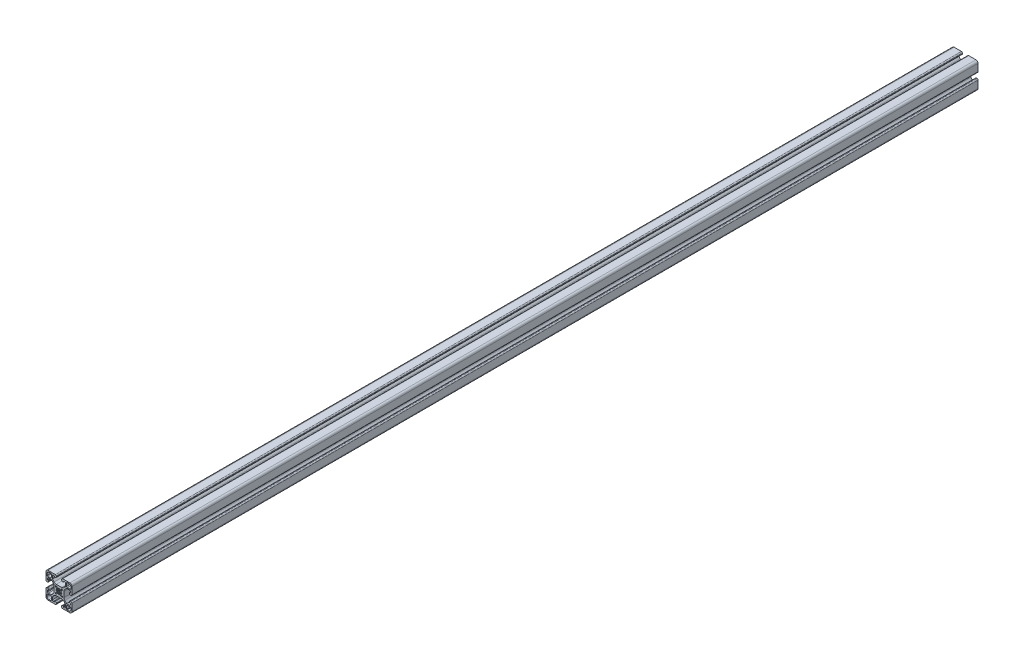
from build123d import *

# Parameters (mm, degrees)
EXTRUDE1_DEPTH = 1400


with BuildPart() as part:
    # Sketch1 → Extrude1 (new body)
    with BuildSketch(Plane.XY):
        with BuildLine():
            Line((-5.63, 20), (-16.83, 20))
            ThreePointArc((-16.83, 20), (-19.071528496, 19.071528497), (-20, 16.83))
            Line((-20, 16.83), (-20, 5.63))
            ThreePointArc((-20, 5.63), (-19.540157646, 4.519842354), (-18.43, 4.06))
            Line((-18.43, 4.06), (-17.57, 4.06))
            ThreePointArc((-17.57, 4.06), (-16.459842353, 4.519842354), (-16, 5.63))
            Line((-16, 5.63), (-16, 6.605))
            ThreePointArc((-16, 6.605), (-16.073223305, 6.781776695), (-16.25, 6.855))
            Line((-16.25, 6.855), (-17.25, 6.855))
            ThreePointArc((-17.25, 6.855), (-17.426776695, 6.928223305), (-17.5, 7.105))
            Line((-17.5, 7.105), (-17.5, 9.015))
            ThreePointArc((-17.5, 9.015), (-17.128025612, 9.913025612), (-16.23, 10.285))
            Line((-16.23, 10.285), (-12.216214636, 10.285))
            ThreePointArc((-12.216214636, 10.285), (-11.875626381, 10.217252784), (-11.5868896, 10.024325035))
            Line((-11.5868896, 10.024325035), (-9.076242789, 7.513678224))
            ThreePointArc((-9.076242789, 7.513678224), (-8.046572221, 5.972667318), (-7.685, 4.154921014))
            Line((-7.685, 4.154921014), (-7.685, -4.154921014))
            ThreePointArc((-7.685, -4.154921014), (-8.046572221, -5.972667317), (-9.076242789, -7.513678224))
            Line((-9.076242789, -7.513678224), (-11.5868896, -10.024325035))
            ThreePointArc((-11.5868896, -10.024325035), (-11.875626381, -10.217252784), (-12.216214636, -10.285))
            Line((-12.216214636, -10.285), (-16.23, -10.285))
            ThreePointArc((-16.23, -10.285), (-17.128025612, -9.913025612), (-17.5, -9.015))
            Line((-17.5, -9.015), (-17.5, -7.105))
            ThreePointArc((-17.5, -7.105), (-17.426776695, -6.928223305), (-17.25, -6.855))
            Line((-17.25, -6.855), (-16.25, -6.855))
            ThreePointArc((-16.25, -6.855), (-16.073223305, -6.781776695), (-16, -6.605))
            Line((-16, -6.605), (-16, -5.63))
            ThreePointArc((-16, -5.63), (-16.459842354, -4.519842353), (-17.57, -4.06))
            Line((-17.57, -4.06), (-18.43, -4.06))
            ThreePointArc((-18.43, -4.06), (-19.540157646, -4.519842353), (-20, -5.63))
            Line((-20, -5.63), (-20, -16.83))
            ThreePointArc((-20, -16.83), (-19.071528496, -19.071528496), (-16.83, -20))
            Line((-16.83, -20), (-5.63, -20))
            ThreePointArc((-5.63, -20), (-4.519842354, -19.540157646), (-4.06, -18.43))
            Line((-4.06, -18.43), (-4.06, -17.57))
            ThreePointArc((-4.06, -17.57), (-4.519842354, -16.459842353), (-5.63, -16))
            Line((-5.63, -16), (-6.605, -16))
            ThreePointArc((-6.605, -16), (-6.781776695, -16.073223305), (-6.855, -16.25))
            Line((-6.855, -16.25), (-6.855, -17.25))
            ThreePointArc((-6.855, -17.25), (-6.928223305, -17.426776695), (-7.105, -17.5))
            Line((-7.105, -17.5), (-9.015, -17.5))
            ThreePointArc((-9.015, -17.5), (-9.913025612, -17.128025612), (-10.285, -16.23))
            Line((-10.285, -16.23), (-10.285, -12.216214635))
            ThreePointArc((-10.285, -12.216214635), (-10.217252784, -11.875626381), (-10.024325035, -11.5868896))
            Line((-10.024325035, -11.5868896), (-7.513678224, -9.076242789))
            ThreePointArc((-7.513678224, -9.076242789), (-5.972667317, -8.04657222), (-4.154921014, -7.685))
            Line((-4.154921014, -7.685), (4.154921014, -7.685))
            ThreePointArc((4.154921014, -7.685), (5.972667317, -8.04657222), (7.513678224, -9.076242789))
            Line((7.513678224, -9.076242789), (10.024325035, -11.5868896))
            ThreePointArc((10.024325035, -11.5868896), (10.217252784, -11.875626381), (10.285, -12.216214636))
            Line((10.285, -12.216214636), (10.285, -16.23))
            ThreePointArc((10.285, -16.23), (9.913025612, -17.128025612), (9.015, -17.5))
            Line((9.015, -17.5), (7.105, -17.5))
            ThreePointArc((7.105, -17.5), (6.928223305, -17.426776695), (6.855, -17.25))
            Line((6.855, -17.25), (6.855, -16.25))
            ThreePointArc((6.855, -16.25), (6.781776695, -16.073223305), (6.605, -16))
            Line((6.605, -16), (5.63, -16))
            ThreePointArc((5.63, -16), (4.519842354, -16.459842353), (4.06, -17.57))
            Line((4.06, -17.57), (4.06, -18.43))
            ThreePointArc((4.06, -18.43), (4.519842354, -19.540157646), (5.63, -20))
            Line((5.63, -20), (16.83, -20))
            ThreePointArc((16.83, -20), (19.071528496, -19.071528496), (20, -16.83))
            Line((20, -16.83), (20, -5.63))
            ThreePointArc((20, -5.63), (19.540157646, -4.519842353), (18.43, -4.06))
            Line((18.43, -4.06), (17.57, -4.06))
            ThreePointArc((17.57, -4.06), (16.459842354, -4.519842353), (16, -5.63))
            Line((16, -5.63), (16, -6.605))
            ThreePointArc((16, -6.605), (16.073223305, -6.781776695), (16.25, -6.855))
            Line((16.25, -6.855), (17.25, -6.855))
            ThreePointArc((17.25, -6.855), (17.426776695, -6.928223305), (17.5, -7.105))
            Line((17.5, -7.105), (17.5, -9.015))
            ThreePointArc((17.5, -9.015), (17.128025612, -9.913025612), (16.23, -10.285))
            Line((16.23, -10.285), (12.216214636, -10.285))
            ThreePointArc((12.216214636, -10.285), (11.875626381, -10.217252784), (11.5868896, -10.024325035))
            Line((11.5868896, -10.024325035), (9.076242789, -7.513678224))
            ThreePointArc((9.076242789, -7.513678224), (8.046572221, -5.972667317), (7.685, -4.154921014))
            Line((7.685, -4.154921014), (7.685, 4.154921014))
            ThreePointArc((7.685, 4.154921014), (8.046572221, 5.972667318), (9.076242789, 7.513678224))
            Line((9.076242789, 7.513678224), (11.5868896, 10.024325035))
            ThreePointArc((11.5868896, 10.024325035), (11.875626381, 10.217252784), (12.216214636, 10.285))
            Line((12.216214636, 10.285), (16.23, 10.285))
            ThreePointArc((16.23, 10.285), (17.128025612, 9.913025612), (17.5, 9.015))
            Line((17.5, 9.015), (17.5, 7.105))
            ThreePointArc((17.5, 7.105), (17.426776695, 6.928223305), (17.25, 6.855))
            Line((17.25, 6.855), (16.25, 6.855))
            ThreePointArc((16.25, 6.855), (16.073223305, 6.781776695), (16, 6.605))
            Line((16, 6.605), (16, 5.63))
            ThreePointArc((16, 5.63), (16.459842354, 4.519842354), (17.57, 4.06))
            Line((17.57, 4.06), (18.43, 4.06))
            ThreePointArc((18.43, 4.06), (19.540157646, 4.519842354), (20, 5.63))
            Line((20, 5.63), (20, 16.83))
            ThreePointArc((20, 16.83), (19.071528496, 19.071528496), (16.83, 20))
            Line((16.83, 20), (5.63, 20))
            ThreePointArc((5.63, 20), (4.519842354, 19.540157647), (4.06, 18.43))
            Line((4.06, 18.43), (4.06, 17.57))
            ThreePointArc((4.06, 17.57), (4.519842354, 16.459842354), (5.63, 16))
            Line((5.63, 16), (6.605, 16))
            ThreePointArc((6.605, 16), (6.781776695, 16.073223305), (6.855, 16.25))
            Line((6.855, 16.25), (6.855, 17.25))
            ThreePointArc((6.855, 17.25), (6.928223305, 17.426776695), (7.105, 17.5))
            Line((7.105, 17.5), (9.015, 17.5))
            ThreePointArc((9.015, 17.5), (9.913025612, 17.128025612), (10.285, 16.23))
            Line((10.285, 16.23), (10.285, 12.216214636))
            ThreePointArc((10.285, 12.216214636), (10.217252784, 11.875626381), (10.024325035, 11.5868896))
            Line((10.024325035, 11.5868896), (7.513678224, 9.07624279))
            ThreePointArc((7.513678224, 9.07624279), (5.972667317, 8.046572221), (4.154921014, 7.685))
            Line((4.154921014, 7.685), (-4.154921014, 7.685))
            ThreePointArc((-4.154921014, 7.685), (-5.972667317, 8.046572221), (-7.513678224, 9.07624279))
            Line((-7.513678224, 9.07624279), (-10.024325035, 11.5868896))
            ThreePointArc((-10.024325035, 11.5868896), (-10.217252784, 11.875626381), (-10.285, 12.216214636))
            Line((-10.285, 12.216214636), (-10.285, 16.23))
            ThreePointArc((-10.285, 16.23), (-9.913025612, 17.128025612), (-9.015, 17.5))
            Line((-9.015, 17.5), (-7.105, 17.5))
            ThreePointArc((-7.105, 17.5), (-6.928223305, 17.426776695), (-6.855, 17.25))
            Line((-6.855, 17.25), (-6.855, 16.25))
            ThreePointArc((-6.855, 16.25), (-6.781776695, 16.073223305), (-6.605, 16))
            Line((-6.605, 16), (-5.63, 16))
            ThreePointArc((-5.63, 16), (-4.519842354, 16.459842354), (-4.06, 17.57))
            Line((-4.06, 17.57), (-4.06, 18.43))
            ThreePointArc((-4.06, 18.43), (-4.519842354, 19.540157647), (-5.63, 20))
        make_face()
        with BuildLine():
            Line((12.4898, -18.345), (15.545, -18.345))
            ThreePointArc((15.545, -18.345), (17.524898987, -17.524898987), (18.345, -15.545))
            Line((18.345, -15.545), (18.345, -12.4898))
            ThreePointArc((18.345, -12.4898), (18.160477272, -12.044322728), (17.715, -11.8598))
            Line((17.715, -11.8598), (13.1298, -11.8598))
            ThreePointArc((13.1298, -11.8598), (12.231774388, -12.231774388), (11.8598, -13.1298))
            Line((11.8598, -13.1298), (11.8598, -17.715))
            ThreePointArc((11.8598, -17.715), (12.044322728, -18.160477272), (12.4898, -18.345))
        make_face(mode=Mode.SUBTRACT)
        with BuildLine():
            Line((-18.345, -12.4898), (-18.345, -15.545))
            ThreePointArc((-18.345, -15.545), (-17.524898987, -17.524898987), (-15.545, -18.345))
            Line((-15.545, -18.345), (-12.4898, -18.345))
            ThreePointArc((-12.4898, -18.345), (-12.044322728, -18.160477272), (-11.8598, -17.715))
            Line((-11.8598, -17.715), (-11.8598, -13.1298))
            ThreePointArc((-11.8598, -13.1298), (-12.231774388, -12.231774388), (-13.1298, -11.8598))
            Line((-13.1298, -11.8598), (-17.715, -11.8598))
            ThreePointArc((-17.715, -11.8598), (-18.160477272, -12.044322728), (-18.345, -12.4898))
        make_face(mode=Mode.SUBTRACT)
        with BuildLine():
            Line((18.345, 12.4898), (18.345, 15.545))
            ThreePointArc((18.345, 15.545), (17.524898987, 17.524898987), (15.545, 18.345))
            Line((15.545, 18.345), (12.4898, 18.345))
            ThreePointArc((12.4898, 18.345), (12.044322728, 18.160477272), (11.8598, 17.715))
            Line((11.8598, 17.715), (11.8598, 13.1298))
            ThreePointArc((11.8598, 13.1298), (12.231774388, 12.231774388), (13.1298, 11.8598))
            Line((13.1298, 11.8598), (17.715, 11.8598))
            ThreePointArc((17.715, 11.8598), (18.160477272, 12.044322728), (18.345, 12.4898))
        make_face(mode=Mode.SUBTRACT)
        with BuildLine():
            Line((-12.4898, 18.345), (-15.545, 18.345))
            ThreePointArc((-15.545, 18.345), (-17.524898987, 17.524898987), (-18.345, 15.545))
            Line((-18.345, 15.545), (-18.345, 12.4898))
            ThreePointArc((-18.345, 12.4898), (-18.160477272, 12.044322728), (-17.715, 11.8598))
            Line((-17.715, 11.8598), (-13.1298, 11.8598))
            ThreePointArc((-13.1298, 11.8598), (-12.231774388, 12.231774388), (-11.8598, 13.1298))
            Line((-11.8598, 13.1298), (-11.8598, 17.715))
            ThreePointArc((-11.8598, 17.715), (-12.044322728, 18.160477272), (-12.4898, 18.345))
        make_face(mode=Mode.SUBTRACT)
        with BuildLine():
            Line((-4.84811685, -5.43930974), (-3.712038621, -5.126252183))
            Line((-3.712038621, -5.126252183), (-1.590718277, -3.00493184))
            ThreePointArc((-1.590718277, -3.00493184), (-1.120609643, -3.210020877), (-0.625, -3.342061489))
            Line((-0.625, -3.342061489), (-0.492259234, -4.087640441))
            ThreePointArc((-0.492259234, -4.087640441), (0, -4.5), (0.492259234, -4.087640441))
            Line((0.492259234, -4.087640441), (0.625, -3.342061489))
            ThreePointArc((0.625, -3.342061489), (1.120609643, -3.210020877), (1.590718277, -3.00493184))
            Line((1.590718277, -3.00493184), (3.712038621, -5.126252183))
            Line((3.712038621, -5.126252183), (4.84811685, -5.43930974))
            ThreePointArc((4.84811685, -5.43930974), (5.303300859, -5.303300859), (5.43930974, -4.84811685))
            Line((5.43930974, -4.84811685), (5.126252183, -3.712038621))
            Line((5.126252183, -3.712038621), (3.00493184, -1.590718277))
            ThreePointArc((3.00493184, -1.590718277), (3.210020877, -1.120609643), (3.342061489, -0.625))
            Line((3.342061489, -0.625), (4.087640441, -0.492259234))
            ThreePointArc((4.087640441, -0.492259234), (4.5, 0), (4.087640441, 0.492259234))
            Line((4.087640441, 0.492259234), (3.342061489, 0.625))
            ThreePointArc((3.342061489, 0.625), (3.210020877, 1.120609643), (3.00493184, 1.590718277))
            Line((3.00493184, 1.590718277), (5.126252183, 3.712038621))
            Line((5.126252183, 3.712038621), (5.43930974, 4.84811685))
            ThreePointArc((5.43930974, 4.84811685), (5.303300859, 5.303300859), (4.84811685, 5.43930974))
            Line((4.84811685, 5.43930974), (3.712038621, 5.126252183))
            Line((3.712038621, 5.126252183), (1.590718277, 3.00493184))
            ThreePointArc((1.590718277, 3.00493184), (1.120609643, 3.210020877), (0.625, 3.342061489))
            Line((0.625, 3.342061489), (0.492259234, 4.087640441))
            ThreePointArc((0.492259234, 4.087640441), (0, 4.5), (-0.492259234, 4.087640441))
            Line((-0.492259234, 4.087640441), (-0.625, 3.342061489))
            ThreePointArc((-0.625, 3.342061489), (-1.120609643, 3.210020877), (-1.590718277, 3.00493184))
            Line((-1.590718277, 3.00493184), (-3.712038621, 5.126252183))
            Line((-3.712038621, 5.126252183), (-4.84811685, 5.43930974))
            ThreePointArc((-4.84811685, 5.43930974), (-5.303300859, 5.303300859), (-5.43930974, 4.84811685))
            Line((-5.43930974, 4.84811685), (-5.126252183, 3.712038621))
            Line((-5.126252183, 3.712038621), (-3.00493184, 1.590718277))
            ThreePointArc((-3.00493184, 1.590718277), (-3.210020877, 1.120609643), (-3.342061489, 0.625))
            Line((-3.342061489, 0.625), (-4.087640441, 0.492259234))
            ThreePointArc((-4.087640441, 0.492259234), (-4.5, 0), (-4.087640441, -0.492259234))
            Line((-4.087640441, -0.492259234), (-3.342061489, -0.625))
            ThreePointArc((-3.342061489, -0.625), (-3.210020877, -1.120609643), (-3.00493184, -1.590718277))
            Line((-3.00493184, -1.590718277), (-5.126252183, -3.712038621))
            Line((-5.126252183, -3.712038621), (-5.43930974, -4.84811685))
            ThreePointArc((-5.43930974, -4.84811685), (-5.303300859, -5.303300859), (-4.84811685, -5.43930974))
        make_face(mode=Mode.SUBTRACT)
    extrude(amount=-EXTRUDE1_DEPTH)


solid = part.part
